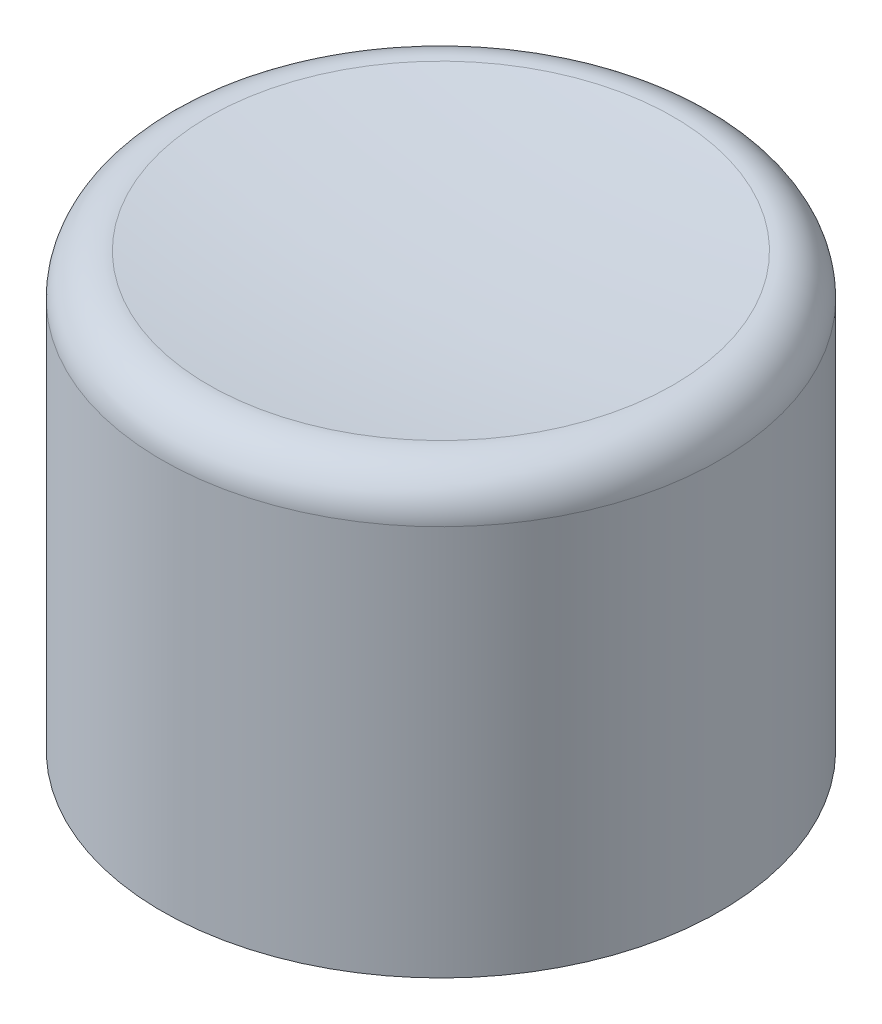
from build123d import *


with BuildPart() as part:
    # Sketch1 → Revolve1 (revolve)
    with BuildSketch(Plane.XY):
        with BuildLine():
            Line((-1.5494, 0), (-1.5494, 3.048))
            Line((-1.5494, 3.048), (0, 3.048))
            Line((0, 3.048), (0, 3.81))
            ThreePointArc((0, 3.81), (-1.058992944, 3.841119954), (-2.114331034, 3.934372414))
            ThreePointArc((-2.114331034, 3.934372414), (-2.412122623, 3.84076295), (-2.54, 3.556))
            Line((-2.54, 3.556), (-2.54, 0))
            Line((-2.54, 0), (-2.159, 0))
            Line((-2.159, 0), (-2.159, 3.048))
            Line((-2.159, 3.048), (-1.9304, 3.048))
            Line((-1.9304, 3.048), (-1.9304, 0))
            Line((-1.9304, 0), (-1.5494, 0))
        make_face()
    revolve(axis=Axis((0, 0, 0), (0, -1, 0)))


solid = part.part
